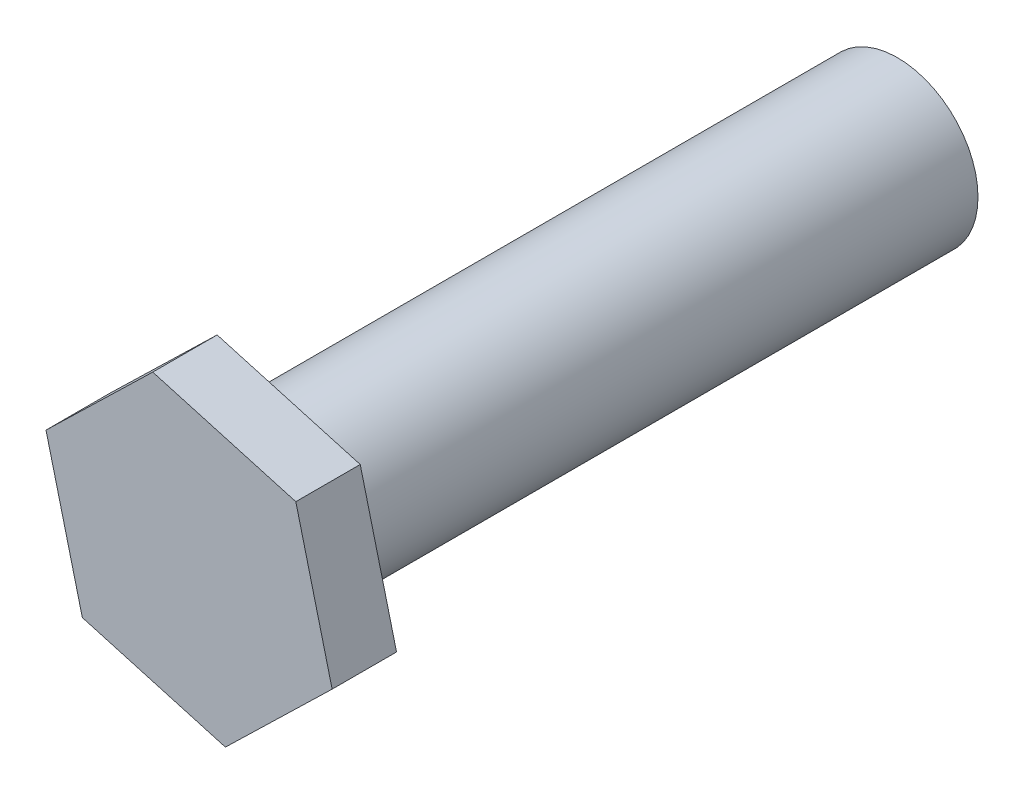
from build123d import *

# Parameters (mm, degrees)
SKETCH_1_R      = 2.5
EXTRUDE_1_DEPTH = 20
EXTRUDE_2_DEPTH = 2


with BuildPart() as part:
    # Эскиз1 → Бобышка-Вытянуть1 (new body)
    with BuildSketch(Plane.XY):
        Circle(SKETCH_1_R)
    extrude(amount=EXTRUDE_1_DEPTH)

    # Эскиз3 → Бобышка-Вытянуть2 (add)
    with BuildSketch(Plane.XY.offset(20)):
        Polygon((3.314953954, 3.216273249), (-1.127897363, 4.478970961), (-4.442851317, 1.262697712), (-3.314953954, -3.216273249), (1.127897363, -4.478970961), (4.442851317, -1.262697712), align=None)
    extrude(amount=EXTRUDE_2_DEPTH)


solid = part.part
